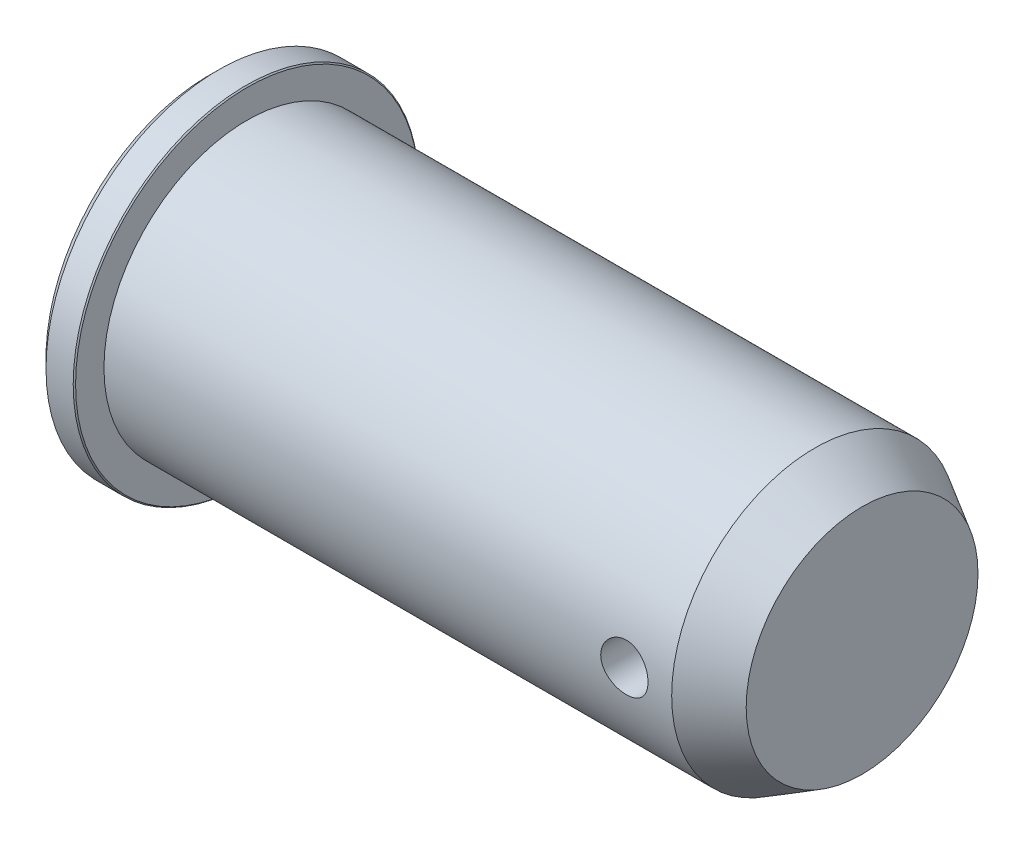
from build123d import *

# Parameters (mm, degrees)
CHAMFER_1_SIZE      = 2
SKETCH_2_R          = 5
CUT_EXTRUDE_1_DEPTH = 162.952153428
CHAMFER_2_SIZE      = 0.25


with BuildPart() as part:
    # 草图1 → 旋转1 (revolve)
    with BuildSketch(Plane.XY, mode=Mode.PRIVATE) as revolve_1_sk:
        Polygon((0, 0), (0, 36.5), (8, 36.5), (8, 30.25), (128, 30.25), (138, 24.5), (138, 0), align=None)
    revolve(revolve_1_sk.sketch.rotate(Axis((0, 0, 0), (1, 0, 0)), 90), axis=Axis((0, 0, 0), (1, 0, 0)))

    # 倒角1
    chamfer_1_edges = [part.edges().sort_by_distance(p)[0] for p in [
        (0, 0, -36.5),
    ]]
    chamfer(chamfer_1_edges, length=CHAMFER_1_SIZE)

    # 草图2 → 切除-拉伸1 (cut, through all)
    with BuildSketch(Plane.XY.offset(40)):
        with Locations((118, 0)):
            Circle(SKETCH_2_R)
    extrude(amount=-CUT_EXTRUDE_1_DEPTH, mode=Mode.SUBTRACT)

    # 倒角2
    chamfer_2_edges = [part.edges().sort_by_distance(p)[0] for p in [
        (8, 0, -36.5),
    ]]
    chamfer(chamfer_2_edges, length=CHAMFER_2_SIZE)


solid = part.part
